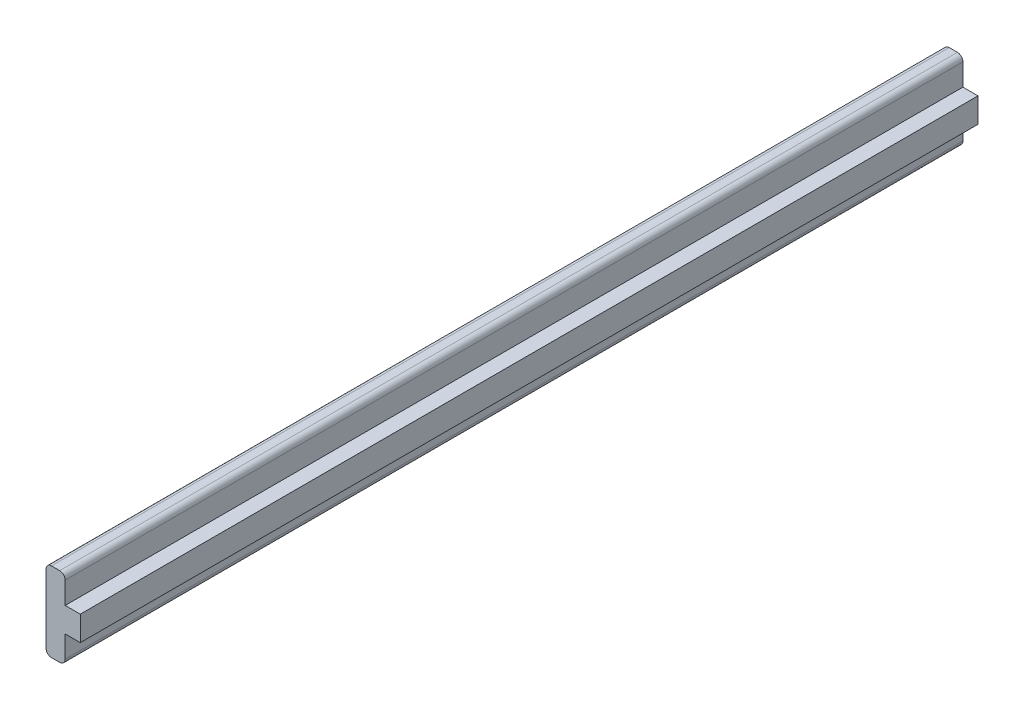
from build123d import *

# Parameters (mm, degrees)
BOSS_EXTRUDE1_DEPTH = 21
CUT_EXTRUDE1_DEPTH  = 22.662179022
BOSS_EXTRUDE2_DEPTH = 49
FILLET1_R           = 0.4
SKETCH4_W           = 7.390362968
SKETCH4_H           = 6.925637862
CUT_EXTRUDE2_DEPTH  = 4.5
CUT_EXTRUDE3_DEPTH  = 66.709283971


with BuildPart() as part:
    # Sketch1 → Boss-Extrude1 (new body)
    with BuildSketch(Plane.XY):
        Polygon((0, 0), (2, 0), (2, 2), (3.5, 2), (3.5, -4), (2, -4), (2, -2), (0, -2), (0, -4), (-1.5, -4), (-1.5, 2), (0, 2), align=None)
    extrude(amount=BOSS_EXTRUDE1_DEPTH)

    # Sketch2 → Cut-Extrude1 (cut, through all)
    with BuildSketch(Plane.XY.offset(21)):
        Polygon((-1.5, 2), (-1.5, 1.9), (-0.1, 1.9), (-0.1, -0.1), (2.1, -0.1), (2.1, 1.9), (3.5, 1.9), (3.5, 2), align=None)
        Polygon((-1.5, -4), (3.5, -4), (3.5, -3.9), (2.1, -3.9), (2.1, -1.9), (-0.1, -1.9), (-0.1, -3.9), (-1.5, -3.9), align=None)
    extrude(amount=-CUT_EXTRUDE1_DEPTH, mode=Mode.SUBTRACT)

    # Sketch3 → Boss-Extrude2 (add)
    with BuildSketch(Plane(origin=(0, 0, 0), x_dir=(-1, 0, 0), z_dir=(0, 0, -1))):
        Polygon((-2.1, -0.1), (-2.1, 1.9), (-3.5, 1.9), (-3.5, -3.9), (-2.1, -3.9), (-2.1, -1.9), (0.1, -1.9), (0.1, -3.9), (1.5, -3.9), (1.5, 1.9), (0.1, 1.9), (0.1, -0.1), align=None)
    extrude(amount=BOSS_EXTRUDE2_DEPTH)

    # Fillet1
    fillet1_edges = [part.edges().sort_by_distance(p)[0] for p in [
        (3.5, 1.9, -14),
        (2.1, 1.9, -14),
        (-0.1, 1.9, -14),
        (-1.5, 1.9, -14),
        (-1.5, -3.9, -14),
        (-0.1, -3.9, -14),
        (2.1, -3.9, -14),
        (3.5, -3.9, -14),
    ]]
    fillet(fillet1_edges, radius=FILLET1_R)

    # Sketch4 → Cut-Extrude2 (cut)
    with BuildSketch(Plane.XY.offset(21)):
        with Locations((1.359853511, -0.992123471)):
            Rectangle(SKETCH4_W, SKETCH4_H)
    extrude(amount=-CUT_EXTRUDE2_DEPTH, mode=Mode.SUBTRACT)

    # Sketch5 → Cut-Extrude3 (cut, through all)
    with BuildSketch(Plane.XY.offset(16.5)):
        Polygon((1, -0.1), (1, -4.471305572), (4.036871247, -4.471305572), (4.036871247, 2.64231625), (1, 2.64231625), align=None)
    extrude(amount=-CUT_EXTRUDE3_DEPTH, mode=Mode.SUBTRACT)


solid = part.part
